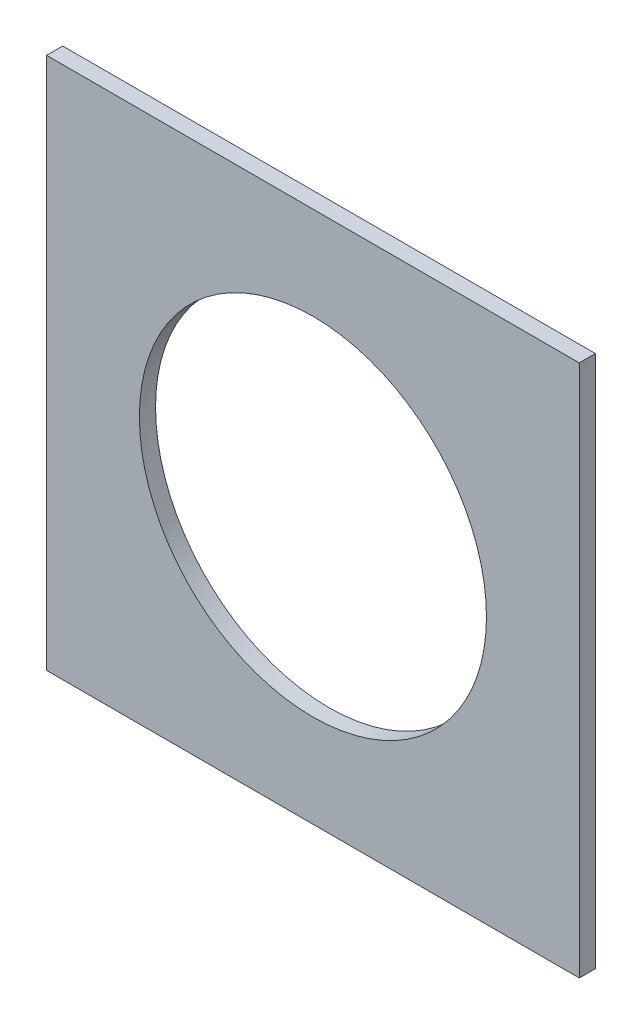
from build123d import *

# Parameters (mm, degrees)
SKETCH1_W           = 330
SKETCH1_H           = 330
BOSS_EXTRUDE1_DEPTH = 10
SKETCH2_R           = 107.5
CUT_EXTRUDE1_DEPTH  = 10


with BuildPart() as part:
    # Sketch1 → Boss-Extrude1 (new body)
    with BuildSketch(Plane.XY):
        Rectangle(SKETCH1_W, SKETCH1_H)
    extrude(amount=-BOSS_EXTRUDE1_DEPTH)

    # Sketch2 → Cut-Extrude1 (cut)
    with BuildSketch(Plane.XY):
        Circle(SKETCH2_R)
    extrude(amount=-CUT_EXTRUDE1_DEPTH, mode=Mode.SUBTRACT)


solid = part.part
